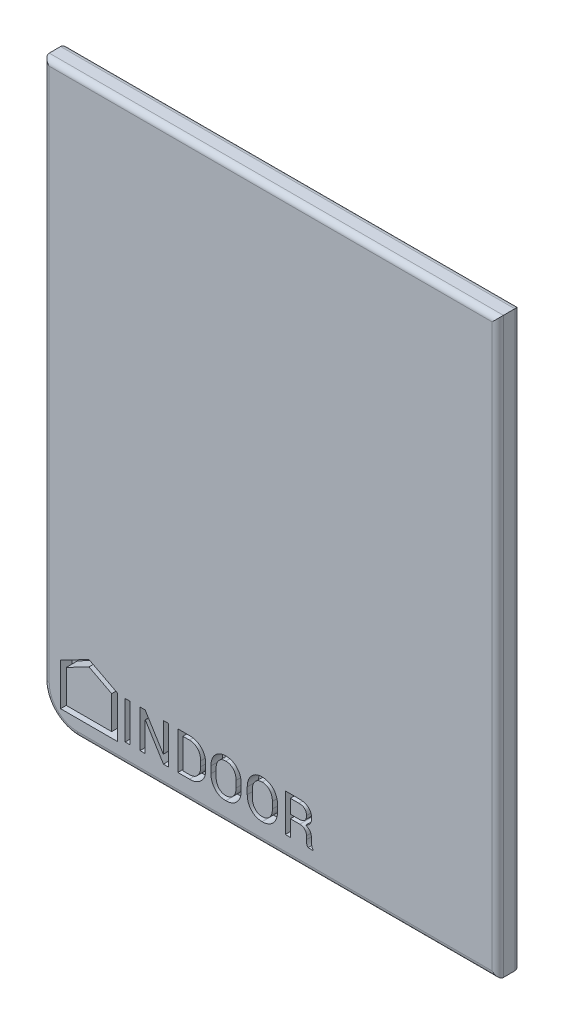
from build123d import *

# Parameters (mm, degrees)
SKETCH1_W             = 3
SKETCH1_H             = 3
BOSS_EXTRUDE1_DEPTH   = 4
BOSS_EXTRUDE1_2_DEPTH = 4
BOSS_EXTRUDE1_3_DEPTH = 4
BOSS_EXTRUDE1_4_DEPTH = 4
BOSS_EXTRUDE2_DEPTH   = 2
FILLET1_R             = 0.5
SKETCH3_W             = 0.451646775
SKETCH3_H             = 3.326928711
CUT_EXTRUDE1_DEPTH    = 1


with BuildPart() as part:
    # Sketch1 → Boss-Extrude1 (new body)
    with BuildSketch(Plane.XY):
        with Locations((-13.5, -36)):
            Rectangle(SKETCH1_W, SKETCH1_H)
    extrude(amount=BOSS_EXTRUDE1_DEPTH)



with BuildPart() as body_2:
    # Sketch1 → Boss-Extrude1 2 (new body)
    with BuildSketch(Plane.XY):
        with Locations((-13.5, -3)):
            Rectangle(SKETCH1_W, SKETCH1_H)
    extrude(amount=BOSS_EXTRUDE1_2_DEPTH)


with BuildPart() as body_3:
    # Sketch1 → Boss-Extrude1 3 (new body)
    with BuildSketch(Plane.XY):
        Polygon((14.899252519, -34.350503737), (11.899402515, -34.380502987), (11.929401765, -37.380352991), (14.929251769, -37.350353741), align=None)
    extrude(amount=BOSS_EXTRUDE1_3_DEPTH)


with BuildPart() as body_4:
    # Sketch1 → Boss-Extrude1 4 (new body)
    with BuildSketch(Plane.XY):
        Polygon((14.569260768, -1.352153696), (14.599260018, -4.3520037), (11.599410015, -4.38200295), (11.569410765, -1.382152946), align=None)
    extrude(amount=BOSS_EXTRUDE1_4_DEPTH)


with BuildPart() as part_1:
    add(part.part)

    add(body_2.part)  # Boss-Extrude2 merges body 2

    add(body_3.part)  # Boss-Extrude2 merges body 3

    add(body_4.part)  # Boss-Extrude2 merges body 4
    # Sketch2 → Boss-Extrude2 (add)
    with BuildSketch(Plane.XY.offset(4)):
        with BuildLine():
            Line((-20.5, -42), (-20.5, 5.5))
            Line((-20.5, 5.5), (19.5, 5.5))
            Line((19.5, 5.5), (19.5, -45))
            Line((19.5, -45), (-17.5, -45))
            ThreePointArc((-17.5, -45), (-19.621320344, -44.121320344), (-20.5, -42))
        make_face()
    extrude(amount=BOSS_EXTRUDE2_DEPTH)

    # Fillet1
    fillet1_edges = [part_1.edges().sort_by_distance(p)[0] for p in [
        (-19.621320344, -44.121320344, 4),
        (1, -45, 4),
        (19.5, -19.75, 4),
        (-0.5, 5.5, 4),
        (-20.5, -18.25, 4),
        (-19.621320344, -44.121320344, 6),
        (1, -45, 6),
        (19.5, -19.75, 6),
        (-0.5, 5.5, 6),
        (-20.5, -18.25, 6),
    ]]
    fillet(fillet1_edges, radius=FILLET1_R)

    # Sketch3 → Cut-Extrude1 (cut)
    # profile 1 of 7: a face of its own
    with BuildSketch(Plane.XY.offset(6)):
        Polygon((-19, -43.5), (-14, -43.5), (-14, -39.8), (-16.5, -38.5), (-19, -39.8), align=None)
        Polygon((-18.5, -40.103560112), (-18.5, -43), (-14.5, -43), (-14.5, -40.103560112), (-16.5, -39.063560112), align=None, mode=Mode.SUBTRACT)
    # profile 2 of 7: a face of its own
    with BuildSketch(Plane.XY.offset(6)):
        with Locations((-13.091432842, -41.536535645)):
            Rectangle(SKETCH3_W, SKETCH3_H)
    # profile 3 of 7: a face of its own
    with BuildSketch(Plane.XY.offset(6)):
        Polygon((-9.49209834, -43.2), (-9.940369579, -43.2), (-11.53767342, -40.625140807), (-11.551850673, -40.629866558), (-11.551850673, -43.2), (-12.000121912, -43.2), (-12.000121912, -39.873071289), (-11.551850673, -39.873071289), (-9.954546832, -42.443204731), (-9.940369579, -42.43847898), (-9.940369579, -39.873071289), (-9.49209834, -39.873071289), align=None)
    # profile 4 of 7: a face of its own
    with BuildSketch(Plane.XY.offset(6)):
        with BuildLine():
            Line((-8.673193201, -43.2), (-8.673193201, -39.873071289))
            Line((-8.673193201, -39.873071289), (-7.655131412, -39.873071289))
            add(Edge.make_bspline(
                [(-7.655131412, -39.873071289), (-7.602194578, -39.874156262), (-7.498443374, -39.876282705), (-7.346936912, -39.895325023), (-7.203677552, -39.927543541), (-7.067798364, -39.969853376), (-6.940856999, -40.027599902), (-6.821195597, -40.096364251), (-6.710113297, -40.178732339), (-6.607660465, -40.272423216), (-6.515466533, -40.376125832), (-6.434749699, -40.487765509), (-6.366575483, -40.607013617), (-6.311343496, -40.733655945), (-6.267915592, -40.867509655), (-6.236903581, -41.008549302), (-6.218470686, -41.157083851), (-6.216257516, -41.258563613), (-6.215127568, -41.310374703)],
                knots=[0, 0, 0, 0, 1.109443129, 2.174403948, 3.194208182, 4.184854246, 5.151957359, 6.111610223, 7.073081873, 8.0447766, 9.017158198, 9.976880633, 10.927738507, 11.891013959, 12.868190143, 13.873155673, 14.914127097, 16, 16, 16, 16], degree=3))
            Line((-6.215127568, -41.310374703), (-6.215127568, -41.764721908))
            add(Edge.make_bspline(
                [(-6.215127568, -41.764721908), (-6.21624399, -41.816759663), (-6.218426042, -41.918467753), (-6.236991295, -42.067427652), (-6.267803437, -42.208737732), (-6.311356845, -42.342786683), (-6.366565239, -42.469440233), (-6.434777335, -42.588657565), (-6.51526613, -42.700274057), (-6.607712754, -42.803327327), (-6.710086912, -42.896463826), (-6.821458125, -42.977864617), (-6.940467835, -43.047252096), (-7.068312425, -43.102595623), (-7.203385651, -43.146750311), (-7.347075222, -43.177408749), (-7.498419301, -43.196880325), (-7.602186445, -43.198946022), (-7.655131412, -43.2)],
                knots=[0, 0, 0, 0, 1.090829904, 2.132033289, 3.141830575, 4.119224504, 5.082714605, 6.03378436, 6.993720651, 7.962798519, 8.931531687, 9.890423648, 10.850290352, 11.813780453, 12.806095564, 13.825111526, 14.890309652, 16, 16, 16, 16], degree=3))
            Line((-7.655131412, -43.2), (-8.673193201, -43.2))
        make_face()
        with BuildLine():
            Line((-8.224921962, -40.21872622), (-8.224921962, -42.854345069))
            Line((-8.224921962, -42.854345069), (-7.655131412, -42.854345069))
            add(Edge.make_bspline(
                [(-7.655131412, -42.854345069), (-7.617734088, -42.853461724), (-7.544683689, -42.851736233), (-7.438045458, -42.837563753), (-7.337796247, -42.812938051), (-7.243021487, -42.78022338), (-7.15514341, -42.736623768), (-7.07295422, -42.684150661), (-6.997208416, -42.621662817), (-6.927888101, -42.55018313), (-6.866121642, -42.471164357), (-6.811389735, -42.38651555), (-6.766726599, -42.2954641), (-6.728305357, -42.200045917), (-6.699276869, -42.098904208), (-6.679632294, -41.992373939), (-6.666025698, -41.880739117), (-6.664733416, -41.80437075), (-6.664073914, -41.765397015)],
                knots=[0, 0, 0, 0, 1.08179551, 2.113134957, 3.104869159, 4.064493385, 5.007944889, 5.936289683, 6.880010757, 7.842348065, 8.811445787, 9.77773973, 10.753203409, 11.741018502, 12.750756824, 13.791487251, 14.872910407, 16, 16, 16, 16], degree=3))
            Line((-6.664073914, -41.765397015), (-6.664073914, -41.30362363))
            add(Edge.make_bspline(
                [(-6.664073914, -41.30362363), (-6.664723239, -41.264873815), (-6.665991701, -41.189175631), (-6.679675177, -41.078446135), (-6.699374682, -40.972612022), (-6.728205724, -40.8718674), (-6.76653738, -40.777042619), (-6.811773038, -40.686978101), (-6.866075151, -40.602555675), (-6.927908609, -40.52358285), (-6.997173213, -40.452032325), (-7.073166151, -40.389698739), (-7.15492175, -40.336328917), (-7.2430522, -40.292895337), (-7.337787664, -40.260119984), (-7.438047878, -40.235511273), (-7.544683039, -40.221334052), (-7.617733868, -40.219609226), (-7.655131412, -40.21872622)],
                knots=[0, 0, 0, 0, 1.123389754, 2.194554098, 3.231481116, 4.243749031, 5.227975322, 6.194223862, 7.162938561, 8.134464063, 9.099212216, 10.045297496, 10.979509224, 11.925324259, 12.887352532, 13.881571224, 14.91549438, 16, 16, 16, 16], degree=3))
            Line((-7.655131412, -40.21872622), (-8.224921962, -40.21872622))
        make_face(mode=Mode.SUBTRACT)
    # profile 5 of 7: a face of its own
    with BuildSketch(Plane.XY.offset(6)):
        with BuildLine():
            add(Edge.make_bspline(
                [(-3.094781687, -41.832907744), (-3.095967271, -41.88246702), (-3.09829758, -41.979877622), (-3.116122833, -42.122940282), (-3.145615877, -42.259460932), (-3.187118215, -42.389407253), (-3.239878669, -42.513032101), (-3.304882433, -42.630324778), (-3.382376511, -42.740670068), (-3.47045793, -42.843631133), (-3.567869604, -42.93709672), (-3.672813879, -43.019359529), (-3.785004244, -43.088880158), (-3.904742057, -43.145076903), (-4.031320111, -43.188838516), (-4.16465561, -43.22077255), (-4.305132364, -43.24004901), (-4.401277598, -43.242139076), (-4.45039712, -43.243206866)],
                knots=[0, 0, 0, 0, 1.084355028, 2.131340168, 3.149469553, 4.136906885, 5.112060551, 6.086430456, 7.066013588, 8.057960014, 9.047164222, 10.015554312, 10.970870312, 11.929177385, 12.904156936, 13.896775516, 14.925486199, 16, 16, 16, 16], degree=3))
            add(Edge.make_bspline(
                [(-4.45039712, -43.243206866), (-4.497719543, -43.242137957), (-4.590508738, -43.240042053), (-4.726259247, -43.220680719), (-4.855176986, -43.188968871), (-4.977412379, -43.144919073), (-5.093060812, -43.088673117), (-5.201738586, -43.019299369), (-5.303290595, -42.936999824), (-5.39731345, -42.8435266), (-5.482142303, -42.740623493), (-5.55596625, -42.629848039), (-5.619225082, -42.513010373), (-5.669615887, -42.38918221), (-5.710100322, -42.259430816), (-5.737659547, -42.122766093), (-5.756191864, -41.979913901), (-5.75789077, -41.882476423), (-5.758755042, -41.832907744)],
                knots=[0, 0, 0, 0, 1.052708774, 2.064137726, 3.044396819, 4.002868507, 4.95033804, 5.900649241, 6.865849142, 7.853907206, 8.846574814, 9.82863622, 10.812330908, 11.798203338, 12.799387751, 13.83270123, 14.897445414, 16, 16, 16, 16], degree=3))
            Line((-5.758755042, -41.832907744), (-5.758755042, -41.242863975))
            add(Edge.make_bspline(
                [(-5.758755042, -41.242863975), (-5.757895998, -41.193295531), (-5.756211242, -41.096081981), (-5.737698838, -40.953664757), (-5.709877884, -40.817301415), (-5.669770586, -40.687441455), (-5.619198936, -40.563447844), (-5.555998067, -40.446575678), (-5.48194403, -40.335759826), (-5.397363437, -40.232226945), (-5.30325761, -40.138192311), (-5.202005479, -40.054970362), (-5.092668314, -39.986075337), (-4.977802152, -39.927816993), (-4.855121451, -39.884213281), (-4.726274708, -39.852359707), (-4.590504636, -39.833037426), (-4.497718158, -39.830936098), (-4.45039712, -39.829864423)],
                knots=[0, 0, 0, 0, 1.101872213, 2.160989971, 3.188764038, 4.194112142, 5.179374413, 6.16246029, 7.143913897, 8.139835891, 9.130815313, 10.098568226, 11.048291278, 11.999608876, 12.957487364, 13.937139773, 14.947942749, 16, 16, 16, 16], degree=3))
            add(Edge.make_bspline(
                [(-4.45039712, -39.829864423), (-4.401278251, -39.8309336), (-4.305134295, -39.833026378), (-4.164648376, -39.852283382), (-4.031346017, -39.884287777), (-3.904556407, -39.92782568), (-3.785176792, -39.98501187), (-3.672810828, -40.054356948), (-3.567665225, -40.136664794), (-3.470452208, -40.230823028), (-3.382534053, -40.334340825), (-3.3050885, -40.444654952), (-3.239533515, -40.561666219), (-3.187146444, -40.685723253), (-3.145816912, -40.815910108), (-3.116024017, -40.952359389), (-3.098287624, -41.095446686), (-3.095965655, -41.193080607), (-3.094781687, -41.242863975)],
                knots=[0, 0, 0, 0, 1.073554424, 2.101346626, 3.093078949, 4.067187993, 5.026748496, 5.981211544, 6.94873701, 7.940469333, 8.935272797, 9.91398131, 10.883181843, 11.861989298, 12.853233264, 13.865646517, 14.911696858, 16, 16, 16, 16], degree=3))
            Line((-3.094781687, -41.242863975), (-3.094781687, -41.832907744))
        make_face()
        with BuildLine():
            add(Edge.make_bspline(
                [(-3.543728033, -41.24151376), (-3.54452313, -41.205026545), (-3.546083003, -41.133443443), (-3.557802573, -41.028712924), (-3.576453662, -40.928811126), (-3.603443823, -40.83382305), (-3.63881461, -40.744128616), (-3.680486308, -40.658947744), (-3.730968152, -40.579447511), (-3.788853789, -40.505742002), (-3.852315643, -40.437952233), (-3.922701233, -40.379867854), (-3.997043982, -40.329173643), (-4.07755107, -40.288287926), (-4.163664197, -40.257516418), (-4.254610413, -40.23527365), (-4.350731608, -40.221380889), (-4.416593604, -40.219626603), (-4.45039712, -40.21872622)],
                knots=[0, 0, 0, 0, 1.139417766, 2.235387377, 3.287171101, 4.310554191, 5.314270234, 6.294983678, 7.268010289, 8.249403534, 9.21886966, 10.161989473, 11.093805827, 12.024242733, 12.973627458, 13.943603024, 14.944559028, 16, 16, 16, 16], degree=3))
            add(Edge.make_bspline(
                [(-4.45039712, -40.21872622), (-4.482403318, -40.219631044), (-4.544910071, -40.221398128), (-4.636095441, -40.235296693), (-4.722191842, -40.257363246), (-4.803429987, -40.288620109), (-4.879670813, -40.329393345), (-4.950498386, -40.379928108), (-5.01749555, -40.438083592), (-5.0775807, -40.505837514), (-5.132150938, -40.57968478), (-5.179560638, -40.659402477), (-5.220552495, -40.743847136), (-5.252412483, -40.834202109), (-5.278441812, -40.928893741), (-5.296191039, -41.028788682), (-5.308349161, -41.133421143), (-5.309315955, -41.205021497), (-5.309808696, -41.24151376)],
                knots=[0, 0, 0, 0, 1.023550512, 1.998950883, 2.943632021, 3.862136067, 4.77687985, 5.701682411, 6.640364115, 7.608938946, 8.592409471, 9.573980893, 10.57220273, 11.590167797, 12.634546576, 13.710555902, 14.833148303, 16, 16, 16, 16], degree=3))
            Line((-5.309808696, -41.24151376), (-5.309808696, -41.826831778))
            add(Edge.make_bspline(
                [(-5.309808696, -41.826831778), (-5.309327228, -41.863774866), (-5.308385279, -41.936050565), (-5.296120729, -42.041792133), (-5.278511581, -42.142604814), (-5.252543198, -42.238009277), (-5.220402117, -42.328706706), (-5.179556902, -42.41364381), (-5.132342394, -42.493952142), (-5.077569243, -42.567909067), (-5.017467137, -42.635618005), (-4.950715417, -42.693904939), (-4.879445097, -42.743579537), (-4.803459911, -42.784493935), (-4.722183567, -42.81569622), (-4.636097751, -42.837777897), (-4.544909452, -42.851672277), (-4.482403109, -42.853439945), (-4.45039712, -42.854345069)],
                knots=[0, 0, 0, 0, 1.177474632, 2.303619041, 3.390314852, 4.438288797, 5.453005825, 6.454517112, 7.439121853, 8.4194544, 9.384938782, 10.320625417, 11.238361827, 12.15018692, 13.065760279, 14.007427205, 14.979715349, 16, 16, 16, 16], degree=3))
            add(Edge.make_bspline(
                [(-4.45039712, -42.854345069), (-4.416605846, -42.853343582), (-4.350352447, -42.85138), (-4.253652298, -42.838777439), (-4.162157203, -42.816390616), (-4.07647928, -42.784548741), (-3.995659285, -42.744412899), (-3.920567458, -42.695068056), (-3.851263351, -42.636131332), (-3.78720752, -42.5696007), (-3.730171641, -42.495292677), (-3.680032727, -42.415587006), (-3.637789224, -42.330292067), (-3.603674474, -42.239736902), (-3.576292766, -42.144073137), (-3.557840814, -42.042988531), (-3.546049161, -41.936703086), (-3.544513141, -41.863995099), (-3.543728033, -41.826831778)],
                knots=[0, 0, 0, 0, 1.051170981, 2.060995147, 3.027046489, 3.974997085, 4.898517996, 5.828516124, 6.762457725, 7.722938656, 8.696065541, 9.671078941, 10.647824718, 11.651491585, 12.677467031, 13.738751904, 14.844205533, 16, 16, 16, 16], degree=3))
            Line((-3.543728033, -41.826831778), (-3.543728033, -41.24151376))
        make_face(mode=Mode.SUBTRACT)
    # profile 6 of 7: a face of its own
    with BuildSketch(Plane.XY.offset(6)):
        with BuildLine():
            add(Edge.make_bspline(
                [(0.102526424, -41.832907744), (0.101340841, -41.88246702), (0.099010532, -41.979877622), (0.081185279, -42.122940282), (0.051692235, -42.259460932), (0.010189897, -42.389407253), (-0.042570557, -42.513032101), (-0.107574321, -42.630324778), (-0.185068399, -42.740670068), (-0.273149819, -42.843631133), (-0.370561492, -42.93709672), (-0.475505767, -43.019359529), (-0.587696132, -43.088880158), (-0.707433946, -43.145076903), (-0.834011999, -43.188838516), (-0.967347498, -43.22077255), (-1.107824252, -43.24004901), (-1.203969486, -43.242139076), (-1.253089008, -43.243206866)],
                knots=[0, 0, 0, 0, 1.084355028, 2.131340168, 3.149469553, 4.136906885, 5.112060551, 6.086430456, 7.066013588, 8.057960014, 9.047164222, 10.015554312, 10.970870312, 11.929177385, 12.904156936, 13.896775516, 14.925486199, 16, 16, 16, 16], degree=3))
            add(Edge.make_bspline(
                [(-1.253089008, -43.243206866), (-1.300411431, -43.242137957), (-1.393200626, -43.240042053), (-1.528951135, -43.220680719), (-1.657868874, -43.188968871), (-1.780104267, -43.144919073), (-1.8957527, -43.088673117), (-2.004430474, -43.019299369), (-2.105982483, -42.936999824), (-2.200005339, -42.8435266), (-2.284834191, -42.740623493), (-2.358658138, -42.629848039), (-2.42191697, -42.513010373), (-2.472307775, -42.38918221), (-2.51279221, -42.259430816), (-2.540351435, -42.122766093), (-2.558883752, -41.979913901), (-2.560582658, -41.882476423), (-2.561446931, -41.832907744)],
                knots=[0, 0, 0, 0, 1.052708774, 2.064137726, 3.044396819, 4.002868507, 4.95033804, 5.900649241, 6.865849142, 7.853907206, 8.846574814, 9.82863622, 10.812330908, 11.798203338, 12.799387751, 13.83270123, 14.897445414, 16, 16, 16, 16], degree=3))
            Line((-2.561446931, -41.832907744), (-2.561446931, -41.242863975))
            add(Edge.make_bspline(
                [(-2.561446931, -41.242863975), (-2.560587886, -41.193295531), (-2.558903131, -41.096081981), (-2.540390727, -40.953664757), (-2.512569773, -40.817301415), (-2.472462474, -40.687441455), (-2.421890824, -40.563447844), (-2.358689955, -40.446575678), (-2.284635918, -40.335759826), (-2.200055325, -40.232226945), (-2.105949498, -40.138192311), (-2.004697367, -40.054970362), (-1.895360202, -39.986075337), (-1.78049404, -39.927816993), (-1.657813339, -39.884213281), (-1.528966596, -39.852359707), (-1.393196524, -39.833037426), (-1.300410046, -39.830936098), (-1.253089008, -39.829864423)],
                knots=[0, 0, 0, 0, 1.101872213, 2.160989971, 3.188764038, 4.194112142, 5.179374413, 6.16246029, 7.143913897, 8.139835891, 9.130815313, 10.098568226, 11.048291278, 11.999608876, 12.957487364, 13.937139773, 14.947942749, 16, 16, 16, 16], degree=3))
            add(Edge.make_bspline(
                [(-1.253089008, -39.829864423), (-1.203970139, -39.8309336), (-1.107826183, -39.833026378), (-0.967340265, -39.852283382), (-0.834037905, -39.884287777), (-0.707248295, -39.92782568), (-0.58786868, -39.98501187), (-0.475502716, -40.054356948), (-0.370357113, -40.136664794), (-0.273144096, -40.230823028), (-0.185225941, -40.334340825), (-0.107780388, -40.444654952), (-0.042225403, -40.561666219), (0.010161667, -40.685723253), (0.0514912, -40.815910108), (0.081284095, -40.952359389), (0.099020488, -41.095446686), (0.101342457, -41.193080607), (0.102526424, -41.242863975)],
                knots=[0, 0, 0, 0, 1.073554424, 2.101346626, 3.093078949, 4.067187993, 5.026748496, 5.981211544, 6.94873701, 7.940469333, 8.935272797, 9.91398131, 10.883181843, 11.861989298, 12.853233264, 13.865646517, 14.911696858, 16, 16, 16, 16], degree=3))
            Line((0.102526424, -41.242863975), (0.102526424, -41.832907744))
        make_face()
        with BuildLine():
            add(Edge.make_bspline(
                [(-0.346419921, -41.24151376), (-0.347215018, -41.205026545), (-0.348774892, -41.133443443), (-0.360494461, -41.028712924), (-0.37914555, -40.928811126), (-0.406135711, -40.83382305), (-0.441506498, -40.744128616), (-0.483178196, -40.658947744), (-0.53366004, -40.579447511), (-0.591545677, -40.505742002), (-0.655007531, -40.437952233), (-0.725393121, -40.379867854), (-0.799735871, -40.329173643), (-0.880242959, -40.288287926), (-0.966356086, -40.257516418), (-1.057302301, -40.23527365), (-1.153423496, -40.221380889), (-1.219285492, -40.219626603), (-1.253089008, -40.21872622)],
                knots=[0, 0, 0, 0, 1.139417766, 2.235387377, 3.287171101, 4.310554191, 5.314270234, 6.294983678, 7.268010289, 8.249403534, 9.21886966, 10.161989473, 11.093805827, 12.024242733, 12.973627458, 13.943603024, 14.944559028, 16, 16, 16, 16], degree=3))
            add(Edge.make_bspline(
                [(-1.253089008, -40.21872622), (-1.285095207, -40.219631044), (-1.347601959, -40.221398128), (-1.438787329, -40.235296693), (-1.52488373, -40.257363246), (-1.606121875, -40.288620109), (-1.682362701, -40.329393345), (-1.753190274, -40.379928108), (-1.820187438, -40.438083592), (-1.880272588, -40.505837514), (-1.934842826, -40.57968478), (-1.982252526, -40.659402477), (-2.023244383, -40.743847136), (-2.055104372, -40.834202109), (-2.0811337, -40.928893741), (-2.098882927, -41.028788682), (-2.111041049, -41.133421143), (-2.112007843, -41.205021497), (-2.112500585, -41.24151376)],
                knots=[0, 0, 0, 0, 1.023550512, 1.998950883, 2.943632021, 3.862136067, 4.77687985, 5.701682411, 6.640364115, 7.608938946, 8.592409471, 9.573980893, 10.57220273, 11.590167797, 12.634546576, 13.710555902, 14.833148303, 16, 16, 16, 16], degree=3))
            Line((-2.112500585, -41.24151376), (-2.112500585, -41.826831778))
            add(Edge.make_bspline(
                [(-2.112500585, -41.826831778), (-2.112019116, -41.863774866), (-2.111077167, -41.936050565), (-2.098812617, -42.041792133), (-2.081203469, -42.142604814), (-2.055235086, -42.238009277), (-2.023094005, -42.328706706), (-1.982248791, -42.41364381), (-1.935034282, -42.493952142), (-1.880261131, -42.567909067), (-1.820159025, -42.635618005), (-1.753407305, -42.693904939), (-1.682136985, -42.743579537), (-1.606151799, -42.784493935), (-1.524875456, -42.81569622), (-1.438789639, -42.837777897), (-1.34760134, -42.851672277), (-1.285094997, -42.853439945), (-1.253089008, -42.854345069)],
                knots=[0, 0, 0, 0, 1.177474632, 2.303619041, 3.390314852, 4.438288797, 5.453005825, 6.454517112, 7.439121853, 8.4194544, 9.384938782, 10.320625417, 11.238361827, 12.15018692, 13.065760279, 14.007427205, 14.979715349, 16, 16, 16, 16], degree=3))
            add(Edge.make_bspline(
                [(-1.253089008, -42.854345069), (-1.219297735, -42.853343582), (-1.153044335, -42.85138), (-1.056344186, -42.838777439), (-0.964849091, -42.816390616), (-0.879171168, -42.784548741), (-0.798351174, -42.744412899), (-0.723259346, -42.695068056), (-0.653955239, -42.636131332), (-0.589899408, -42.5696007), (-0.532863529, -42.495292677), (-0.482724615, -42.415587006), (-0.440481112, -42.330292067), (-0.406366362, -42.239736902), (-0.378984654, -42.144073137), (-0.360532703, -42.042988531), (-0.348741049, -41.936703086), (-0.347205029, -41.863995099), (-0.346419921, -41.826831778)],
                knots=[0, 0, 0, 0, 1.051170981, 2.060995147, 3.027046489, 3.974997085, 4.898517996, 5.828516124, 6.762457725, 7.722938656, 8.696065541, 9.671078941, 10.647824718, 11.651491585, 12.677467031, 13.738751904, 14.844205533, 16, 16, 16, 16], degree=3))
            Line((-0.346419921, -41.826831778), (-0.346419921, -41.24151376))
        make_face(mode=Mode.SUBTRACT)
    # profile 7 of 7: a face of its own
    with BuildSketch(Plane.XY.offset(6)):
        with BuildLine():
            Line((1.237381774, -41.77417341), (1.237381774, -43.2))
            Line((1.237381774, -43.2), (0.789110535, -43.2))
            Line((0.789110535, -43.2), (0.789110535, -39.873071289))
            Line((0.789110535, -39.873071289), (1.989451292, -39.873071289))
            add(Edge.make_bspline(
                [(1.989451292, -39.873071289), (2.033586127, -39.873844852), (2.119310643, -39.875347367), (2.24379818, -39.887049985), (2.360387049, -39.905407124), (2.468727297, -39.932560844), (2.569333724, -39.966657089), (2.6615508, -40.009403985), (2.745871439, -40.059438998), (2.822005636, -40.117153194), (2.889801895, -40.181936817), (2.948561076, -40.254301301), (2.99765266, -40.33370152), (3.039041687, -40.41966295), (3.069431927, -40.513132439), (3.09181568, -40.613249085), (3.10541413, -40.720185013), (3.107191345, -40.793877487), (3.108104067, -40.831723637)],
                knots=[0, 0, 0, 0, 1.261240677, 2.449748544, 3.570596225, 4.631370439, 5.638222945, 6.60225553, 7.531034473, 8.435372624, 9.326972495, 10.204919376, 11.091913869, 11.989525322, 12.925138508, 13.89415752, 14.918505167, 16, 16, 16, 16], degree=3))
            add(Edge.make_bspline(
                [(3.108104067, -40.831723637), (3.106699993, -40.873714702), (3.103963218, -40.955562369), (3.078134515, -41.07401874), (3.036077109, -41.184160497), (2.976720575, -41.285422946), (2.901488935, -41.377306234), (2.811330549, -41.459657775), (2.705688127, -41.53209724), (2.626882245, -41.569768761), (2.586246134, -41.589194013)],
                knots=[0, 0, 0, 0, 1.028862839, 2.005427192, 2.957774849, 3.910202492, 4.871467158, 5.859925103, 6.896474221, 8, 8, 8, 8], degree=3))
            add(Edge.make_bspline(
                [(2.586246134, -41.589194013), (2.608442997, -41.596702135), (2.651647793, -41.611316221), (2.712783188, -41.638958407), (2.769791917, -41.668698527), (2.820963636, -41.703682756), (2.868345344, -41.740679826), (2.909885986, -41.782144415), (2.947763713, -41.826220111), (2.990819716, -41.890825525), (3.035259378, -41.979817687), (3.073066618, -42.097206875), (3.095474327, -42.226317513), (3.098010537, -42.316192179), (3.099327672, -42.362866964)],
                knots=[0, 0, 0, 0, 0.838653291, 1.63238576, 2.400374967, 3.137994717, 3.849118951, 4.550078159, 5.236288537, 5.926980145, 7.325396339, 8.783186204, 10.329405852, 12, 12, 12, 12], degree=3))
            Line((3.099327672, -42.362866964), (3.099327672, -42.672066101))
            add(Edge.make_bspline(
                [(3.099327672, -42.672066101), (3.09959553, -42.697067919), (3.10011542, -42.745594311), (3.107641164, -42.816509179), (3.116971757, -42.883687789), (3.131903785, -42.946763483), (3.151380462, -43.005372354), (3.179381248, -43.057591085), (3.211063468, -43.106015782), (3.238326945, -43.132703249), (3.251901919, -43.145991417)],
                knots=[0, 0, 0, 0, 1.170223219, 2.271303375, 3.336963783, 4.34411319, 5.30400336, 6.218444636, 7.112931618, 8, 8, 8, 8], degree=3))
            Line((3.251901919, -43.145991417), (3.251901919, -43.2))
            Line((3.251901919, -43.2), (2.789453427, -43.2))
            add(Edge.make_bspline(
                [(2.789453427, -43.2), (2.775298703, -43.186129516), (2.746503746, -43.157912789), (2.714527496, -43.104108115), (2.688778284, -43.042685708), (2.669400406, -42.947582139), (2.653759093, -42.821576913), (2.651516137, -42.718710108), (2.650381326, -42.666665243)],
                knots=[0, 0, 0, 0, 0.627050846, 1.275609541, 1.971149823, 2.734054394, 4.347613721, 6, 6, 6, 6], degree=3))
            Line((2.650381326, -42.666665243), (2.650381326, -42.3662425))
            add(Edge.make_bspline(
                [(2.650381326, -42.3662425), (2.649829937, -42.34461789), (2.648746831, -42.302140184), (2.641216504, -42.240028007), (2.629117907, -42.181066434), (2.612427438, -42.12525958), (2.589903872, -42.07312603), (2.562847285, -42.024212019), (2.530720078, -41.978502688), (2.493998317, -41.936228967), (2.452651592, -41.898662796), (2.40843963, -41.864924195), (2.360548819, -41.836818089), (2.30930897, -41.813329816), (2.254515373, -41.796283381), (2.196565632, -41.783056241), (2.135229475, -41.775876359), (2.09320939, -41.774747951), (2.071814381, -41.77417341)],
                knots=[0, 0, 0, 0, 1.111690212, 2.183717978, 3.211632343, 4.203491501, 5.17275658, 6.125725646, 7.072635107, 8.04024143, 8.998324043, 9.940130362, 10.894573255, 11.847331589, 12.831603679, 13.839329306, 14.899869719, 16, 16, 16, 16], degree=3))
            Line((2.071814381, -41.77417341), (1.237381774, -41.77417341))
        make_face()
        with BuildLine():
            Line((1.237381774, -41.428518479), (1.944219104, -41.428518479))
            add(Edge.make_bspline(
                [(1.944219104, -41.428518479), (1.974844628, -41.428296656), (2.033944794, -41.427868591), (2.119105424, -41.419923589), (2.19770129, -41.408989622), (2.269723556, -41.392711252), (2.335244989, -41.372248206), (2.394045051, -41.346290402), (2.446406453, -41.316079167), (2.492283432, -41.280620921), (2.531729991, -41.240031536), (2.566606777, -41.195574938), (2.595000428, -41.145285127), (2.61859379, -41.090752566), (2.636735661, -41.031148968), (2.650501669, -40.966847206), (2.657441621, -40.897361698), (2.658575931, -40.849513846), (2.659157721, -40.824972564)],
                knots=[0, 0, 0, 0, 1.362270418, 2.628866247, 3.802928576, 4.891308445, 5.911092364, 6.852645673, 7.745769292, 8.595094103, 9.423618893, 10.25889447, 11.102294789, 11.985936038, 12.898168445, 13.87037705, 14.907711121, 16, 16, 16, 16], degree=3))
            add(Edge.make_bspline(
                [(2.659157721, -40.824972564), (2.658600238, -40.801551539), (2.657514526, -40.755938516), (2.650219593, -40.689473485), (2.637271881, -40.627174154), (2.61989919, -40.568698122), (2.597088703, -40.514403673), (2.5681373, -40.464726378), (2.535110163, -40.418644839), (2.497191245, -40.376356302), (2.453449796, -40.338870752), (2.403883791, -40.306200112), (2.348198992, -40.279642587), (2.287467467, -40.257097639), (2.221030129, -40.23952599), (2.148658858, -40.227867489), (2.070849317, -40.220279029), (2.017149655, -40.219254615), (1.989451292, -40.21872622)],
                knots=[0, 0, 0, 0, 1.08740595, 2.117749803, 3.09925982, 4.037962281, 4.946166163, 5.826104743, 6.701815216, 7.574716416, 8.456390088, 9.369209802, 10.322452341, 11.314196783, 12.373533284, 13.507188397, 14.714204154, 16, 16, 16, 16], degree=3))
            Line((1.989451292, -40.21872622), (1.237381774, -40.21872622))
            Line((1.237381774, -40.21872622), (1.237381774, -41.428518479))
        make_face(mode=Mode.SUBTRACT)
    extrude(amount=-CUT_EXTRUDE1_DEPTH, mode=Mode.SUBTRACT)


solid = part_1.part
